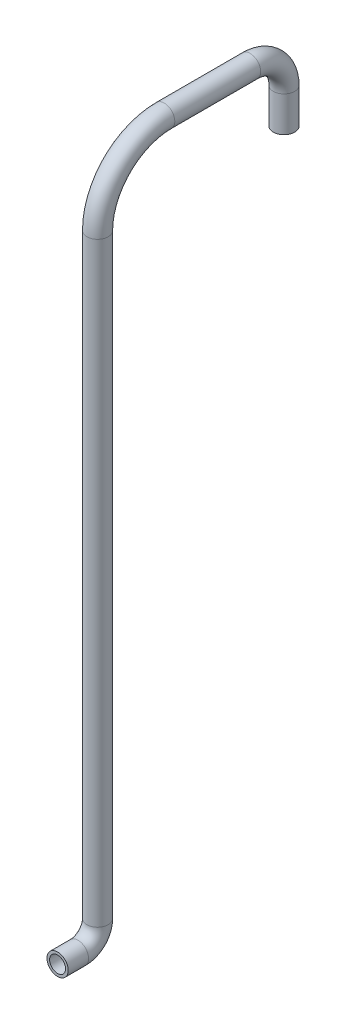
from build123d import *

# Parameters (mm, degrees)
SWEEP1_PROFILE_R                           = 4
HOLLOW_TUBE_OD_AND_WALL_PROVISIONAL_PROF_R = 3


with BuildPart() as part:
    # Sweep1: sweep along a curve in space
    with BuildLine() as sweep1_path:
        Line((0, 0, 0), (0, 0, -7.65000054))
        ThreePointArc((0, 0, -7.65000054), (0, 2.152765191, -12.847235191), (0, 7.35, -15))
        Line((0, 7.35, -15), (0, 231.000001606, -15))
        ThreePointArc((0, 231.000001606, -15), (0, 248.677670568, -22.322330568), (0, 256, -40))
        Line((0, 256, -40), (0, 256, -72.259998661))
        ThreePointArc((0, 256, -72.259998661), (0, 252.268540474, -81.268539526), (0, 243.26, -85))
        Line((0, 243.26, -85), (0, 230, -85))
    # Sweep1 profile (on start of the path) → Sweep1 (sweep)
    with BuildSketch(Plane(origin=(0, 0, 0), x_dir=(-1, 0, 0), z_dir=(0, 0, -1))):
        Circle(SWEEP1_PROFILE_R)
    sweep(path=sweep1_path.line)

    # Hollow_tube_OD_and_wall_PROVISIONAL: sweep along a curve in space
    with BuildLine() as hollow_tube_od_and_wall_provisional_path:
        Line((0, 0, 0), (0, 0, -7.65000054))
        ThreePointArc((0, 0, -7.65000054), (0, 2.152765191, -12.847235191), (0, 7.35, -15))
        Line((0, 7.35, -15), (0, 231.000001606, -15))
        ThreePointArc((0, 231.000001606, -15), (0, 248.677670568, -22.322330568), (0, 256, -40))
        Line((0, 256, -40), (0, 256, -72.259998661))
        ThreePointArc((0, 256, -72.259998661), (0, 252.268540474, -81.268539526), (0, 243.26, -85))
        Line((0, 243.26, -85), (0, 230, -85))
    # Hollow_tube_OD_and_wall_PROVISIONAL prof (on start of the path) → Hollow_tube_OD_and_wall_PROVISIONAL (sweep, cut)
    with BuildSketch(Plane(origin=(0, 0, 0), x_dir=(-1, 0, 0), z_dir=(0, 0, -1))):
        Circle(HOLLOW_TUBE_OD_AND_WALL_PROVISIONAL_PROF_R)
    sweep(path=hollow_tube_od_and_wall_provisional_path.line, mode=Mode.SUBTRACT)


solid = part.part
